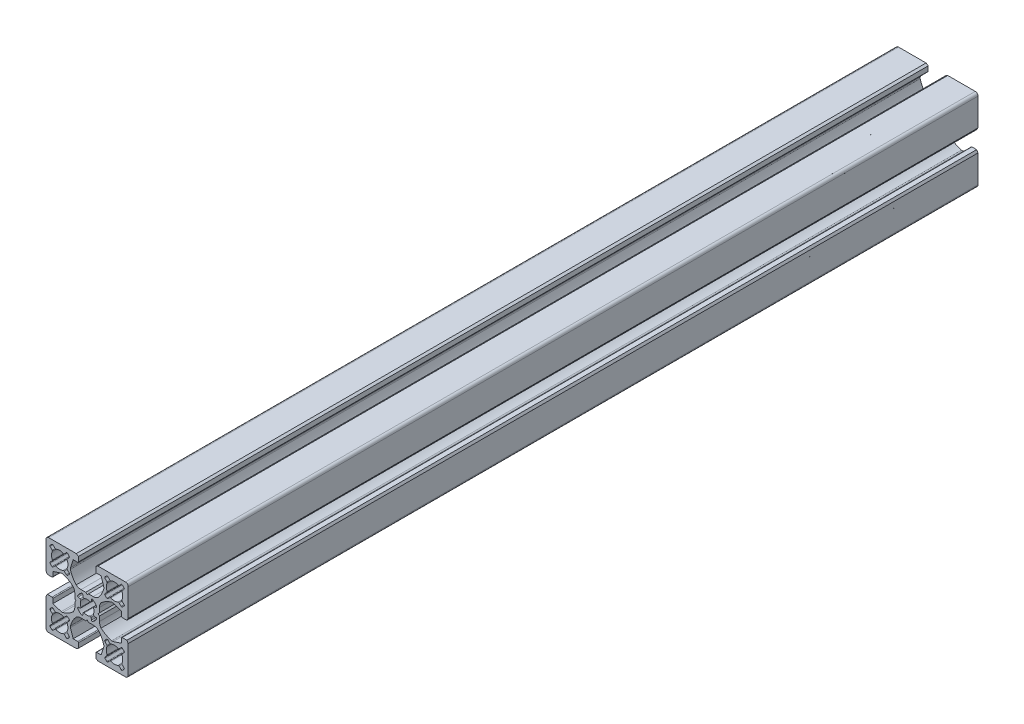
from build123d import *

# Parameters (mm, degrees)
EXTRUDE_1_DEPTH = 310


with BuildPart() as part:
    # Model → 보스-돌출1 (new body)
    with BuildSketch(Plane.XY):
        with BuildLine():
            Line((459.574175407, 182.783831091), (458.774175407, 183.283831091))
            Line((458.774175407, 183.283831091), (458.774175407, 184.983831091))
            ThreePointArc((458.774175407, 184.983831091), (458.862043373, 185.195963125), (459.074175407, 185.283831091))
            Line((459.074175407, 185.283831091), (460.724175407, 185.283831091))
            Line((460.724175407, 185.283831091), (461.711783237, 188.335604532))
            ThreePointArc((461.711783237, 188.335604532), (461.759141443, 188.594081667), (461.737530794, 188.855971354))
            ThreePointArc((461.737530794, 188.855971354), (460.898837663, 190.893750972), (459.628188183, 192.694140329))
            ThreePointArc((459.628188183, 192.694140329), (458.78251429, 193.132596412), (457.842016473, 193.283831091))
            Line((457.842016473, 193.283831091), (456.124175407, 193.283831091))
            Line((456.124175407, 193.283831091), (455.624175407, 193.783831091))
            Line((455.624175407, 193.783831091), (455.124175407, 193.283831091))
            Line((455.124175407, 193.283831091), (453.406334341, 193.283831091))
            ThreePointArc((453.406334341, 193.283831091), (452.465836525, 193.132596412), (451.620162632, 192.694140329))
            ThreePointArc((451.620162632, 192.694140329), (450.349513151, 190.893750972), (449.510820021, 188.855971354))
            ThreePointArc((449.510820021, 188.855971354), (449.489209372, 188.594081667), (449.536567578, 188.335604532))
            Line((449.536567578, 188.335604532), (450.524175407, 185.283831091))
            Line((450.524175407, 185.283831091), (452.174175407, 185.283831091))
            ThreePointArc((452.174175407, 185.283831091), (452.386307442, 185.195963125), (452.474175407, 184.983831091))
            Line((452.474175407, 184.983831091), (452.474175407, 183.283831091))
            Line((452.474175407, 183.283831091), (451.674175407, 182.783831091))
            Line((451.674175407, 182.783831091), (441.624175407, 182.783831091))
            ThreePointArc((441.624175407, 182.783831091), (440.917068626, 183.076724309), (440.624175407, 183.783831091))
            Line((440.624175407, 183.783831091), (440.624175407, 193.833831091))
            Line((440.624175407, 193.833831091), (441.124175407, 194.633831091))
            Line((441.124175407, 194.633831091), (442.824175407, 194.633831091))
            ThreePointArc((442.824175407, 194.633831091), (443.036307442, 194.545963125), (443.124175407, 194.333831091))
            Line((443.124175407, 194.333831091), (443.124175407, 192.683831091))
            Line((443.124175407, 192.683831091), (446.175948849, 191.696223261))
            ThreePointArc((446.175948849, 191.696223261), (446.434425983, 191.648865055), (446.696315671, 191.670475704))
            ThreePointArc((446.696315671, 191.670475704), (448.734095289, 192.509168835), (450.534484646, 193.779818315))
            ThreePointArc((450.534484646, 193.779818315), (450.972940729, 194.625492208), (451.124175407, 195.565990025))
            Line((451.124175407, 195.565990025), (451.124175407, 197.283831091))
            Line((451.124175407, 197.283831091), (451.624175407, 197.783831091))
            Line((451.624175407, 197.783831091), (451.124175407, 198.283831091))
            Line((451.124175407, 198.283831091), (451.124175407, 200.001672157))
            ThreePointArc((451.124175407, 200.001672157), (450.972940729, 200.942169973), (450.534484646, 201.787843866))
            ThreePointArc((450.534484646, 201.787843866), (448.734095289, 203.058493347), (446.696315671, 203.897186477))
            ThreePointArc((446.696315671, 203.897186477), (446.434425983, 203.918797126), (446.175948849, 203.87143892))
            Line((446.175948849, 203.87143892), (443.124175407, 202.883831091))
            Line((443.124175407, 202.883831091), (443.124175407, 201.233831091))
            ThreePointArc((443.124175407, 201.233831091), (443.036307442, 201.021699056), (442.824175407, 200.933831091))
            Line((442.824175407, 200.933831091), (441.124175407, 200.933831091))
            Line((441.124175407, 200.933831091), (440.624175407, 201.733831091))
            Line((440.624175407, 201.733831091), (440.624175407, 211.783831091))
            ThreePointArc((440.624175407, 211.783831091), (440.917068626, 212.490937872), (441.624175407, 212.783831091))
            Line((441.624175407, 212.783831091), (451.674175407, 212.783831091))
            Line((451.674175407, 212.783831091), (452.474175407, 212.283831091))
            Line((452.474175407, 212.283831091), (452.474175407, 210.583831091))
            ThreePointArc((452.474175407, 210.583831091), (452.386307442, 210.371699056), (452.174175407, 210.283831091))
            Line((452.174175407, 210.283831091), (450.524175407, 210.283831091))
            Line((450.524175407, 210.283831091), (449.536567578, 207.232057649))
            ThreePointArc((449.536567578, 207.232057649), (449.489209372, 206.973580515), (449.510820021, 206.711690827))
            ThreePointArc((449.510820021, 206.711690827), (450.349513151, 204.673911209), (451.620162632, 202.873521852))
            ThreePointArc((451.620162632, 202.873521852), (452.465836525, 202.435065769), (453.406334341, 202.283831091))
            Line((453.406334341, 202.283831091), (455.124175407, 202.283831091))
            Line((455.124175407, 202.283831091), (455.624175407, 201.783831091))
            Line((455.624175407, 201.783831091), (456.124175407, 202.283831091))
            Line((456.124175407, 202.283831091), (457.842016473, 202.283831091))
            ThreePointArc((457.842016473, 202.283831091), (458.78251429, 202.435065769), (459.628188183, 202.873521852))
            ThreePointArc((459.628188183, 202.873521852), (460.898837663, 204.673911209), (461.737530794, 206.711690827))
            ThreePointArc((461.737530794, 206.711690827), (461.759141443, 206.973580515), (461.711783237, 207.232057649))
            Line((461.711783237, 207.232057649), (460.724175407, 210.283831091))
            Line((460.724175407, 210.283831091), (459.074175407, 210.283831091))
            ThreePointArc((459.074175407, 210.283831091), (458.862043373, 210.371699056), (458.774175407, 210.583831091))
            Line((458.774175407, 210.583831091), (458.774175407, 212.283831091))
            Line((458.774175407, 212.283831091), (459.574175407, 212.783831091))
            Line((459.574175407, 212.783831091), (469.624175407, 212.783831091))
            ThreePointArc((469.624175407, 212.783831091), (470.331282189, 212.490937872), (470.624175407, 211.783831091))
            Line((470.624175407, 211.783831091), (470.624175407, 201.733831091))
            Line((470.624175407, 201.733831091), (470.124175407, 200.933831091))
            Line((470.124175407, 200.933831091), (468.424175407, 200.933831091))
            ThreePointArc((468.424175407, 200.933831091), (468.212043373, 201.021699056), (468.124175407, 201.233831091))
            Line((468.124175407, 201.233831091), (468.124175407, 202.883831091))
            Line((468.124175407, 202.883831091), (465.072401966, 203.87143892))
            ThreePointArc((465.072401966, 203.87143892), (464.813924831, 203.918797126), (464.552035144, 203.897186477))
            ThreePointArc((464.552035144, 203.897186477), (462.514255526, 203.058493347), (460.713866169, 201.787843866))
            ThreePointArc((460.713866169, 201.787843866), (460.275410086, 200.942169973), (460.124175407, 200.001672157))
            Line((460.124175407, 200.001672157), (460.124175407, 198.283831091))
            Line((460.124175407, 198.283831091), (459.624175407, 197.783831091))
            Line((459.624175407, 197.783831091), (460.124175407, 197.283831091))
            Line((460.124175407, 197.283831091), (460.124175407, 195.565990025))
            ThreePointArc((460.124175407, 195.565990025), (460.275410086, 194.625492208), (460.713866169, 193.779818315))
            ThreePointArc((460.713866169, 193.779818315), (462.514255526, 192.509168835), (464.552035144, 191.670475704))
            ThreePointArc((464.552035144, 191.670475704), (464.813924831, 191.648865055), (465.072401966, 191.696223261))
            Line((465.072401966, 191.696223261), (468.124175407, 192.683831091))
            Line((468.124175407, 192.683831091), (468.124175407, 194.333831091))
            ThreePointArc((468.124175407, 194.333831091), (468.212043373, 194.545963125), (468.424175407, 194.633831091))
            Line((468.424175407, 194.633831091), (470.124175407, 194.633831091))
            Line((470.124175407, 194.633831091), (470.624175407, 193.833831091))
            Line((470.624175407, 193.833831091), (470.624175407, 183.783831091))
            ThreePointArc((470.624175407, 183.783831091), (470.331282189, 183.076724309), (469.624175407, 182.783831091))
            Line((469.624175407, 182.783831091), (459.574175407, 182.783831091))
        make_face()
        with BuildLine():
            Line((462.879323242, 206.101978996), (462.138752469, 205.361408224))
            ThreePointArc((462.138752469, 205.361408224), (462.051316542, 205.165370796), (462.117245146, 204.961093696))
            ThreePointArc((462.117245146, 204.961093696), (462.439854993, 204.601850575), (462.799098114, 204.279240729))
            ThreePointArc((462.799098114, 204.279240729), (463.003375214, 204.213312125), (463.199412641, 204.300748052))
            Line((463.199412641, 204.300748052), (463.939983413, 205.041318824))
            ThreePointArc((463.939983413, 205.041318824), (464.103755722, 205.125263363), (464.285726362, 205.097790817))
            ThreePointArc((464.285726362, 205.097790817), (465.621835508, 204.783831091), (466.957944654, 205.097790817))
            ThreePointArc((466.957944654, 205.097790817), (467.139915294, 205.125263363), (467.303687603, 205.041318824))
            Line((467.303687603, 205.041318824), (468.044258375, 204.300748052))
            ThreePointArc((468.044258375, 204.300748052), (468.240295802, 204.213312125), (468.444572902, 204.279240729))
            ThreePointArc((468.444572902, 204.279240729), (468.803816023, 204.601850575), (469.12642587, 204.961093696))
            ThreePointArc((469.12642587, 204.961093696), (469.192354474, 205.165370796), (469.104918547, 205.361408224))
            Line((469.104918547, 205.361408224), (468.364347775, 206.101978996))
            ThreePointArc((468.364347775, 206.101978996), (468.280403236, 206.265751305), (468.307875782, 206.447721945))
            ThreePointArc((468.307875782, 206.447721945), (468.621835508, 207.783831091), (468.307875782, 209.119940236))
            ThreePointArc((468.307875782, 209.119940236), (468.280403236, 209.301910877), (468.364347774, 209.465683185))
            Line((468.364347774, 209.465683185), (469.104918547, 210.206253957))
            ThreePointArc((469.104918547, 210.206253957), (469.192354474, 210.402291385), (469.12642587, 210.606568485))
            ThreePointArc((469.12642587, 210.606568485), (468.803816023, 210.965811606), (468.444572902, 211.288421452))
            ThreePointArc((468.444572902, 211.288421452), (468.240295802, 211.354350057), (468.044258375, 211.266914129))
            Line((468.044258375, 211.266914129), (467.303687603, 210.526343357))
            ThreePointArc((467.303687603, 210.526343357), (467.139915294, 210.442398819), (466.957944654, 210.469871364))
            ThreePointArc((466.957944654, 210.469871364), (465.621835508, 210.783831091), (464.285726362, 210.469871364))
            ThreePointArc((464.285726362, 210.469871364), (464.103755722, 210.442398819), (463.939983413, 210.526343357))
            Line((463.939983413, 210.526343357), (463.199412641, 211.266914129))
            ThreePointArc((463.199412641, 211.266914129), (463.003375214, 211.354350057), (462.799098114, 211.288421452))
            ThreePointArc((462.799098114, 211.288421452), (462.439854993, 210.965811606), (462.117245146, 210.606568485))
            ThreePointArc((462.117245146, 210.606568485), (462.051316542, 210.402291385), (462.138752469, 210.206253957))
            Line((462.138752469, 210.206253957), (462.879323242, 209.465683185))
            ThreePointArc((462.879323242, 209.465683185), (462.96326778, 209.301910877), (462.935795235, 209.119940236))
            ThreePointArc((462.935795235, 209.119940236), (462.621835508, 207.783831091), (462.935795235, 206.447721945))
            ThreePointArc((462.935795235, 206.447721945), (462.96326778, 206.265751305), (462.879323242, 206.101978996))
        make_face(mode=Mode.SUBTRACT)
        with BuildLine():
            Line((462.878674407, 189.465117129), (462.138161401, 190.205745663))
            ThreePointArc((462.138161401, 190.205745663), (462.050740765, 190.40178991), (462.116685302, 190.606061867))
            ThreePointArc((462.116685302, 190.606061867), (462.439323169, 190.965279823), (462.798591452, 191.287861648))
            ThreePointArc((462.798591452, 191.287861648), (463.002873694, 191.353774318), (463.198904301, 191.2663231))
            Line((463.198904301, 191.2663231), (463.939417306, 190.525694566))
            ThreePointArc((463.939417306, 190.525694566), (464.103183067, 190.441737254), (464.285155849, 190.469195606))
            ThreePointArc((464.285155849, 190.469195606), (465.62128948, 190.783051115), (466.957374133, 190.468987173))
            ThreePointArc((466.957374133, 190.468987173), (467.13934263, 190.441500434), (467.303121485, 190.525432198))
            Line((467.303121485, 190.525432198), (468.04375002, 191.265945204))
            ThreePointArc((468.04375002, 191.265945204), (468.239794266, 191.35336584), (468.444066223, 191.287421303))
            ThreePointArc((468.444066223, 191.287421303), (468.80328418, 190.964783436), (469.125866004, 190.605515153))
            ThreePointArc((469.125866004, 190.605515153), (469.191778675, 190.401232911), (469.104327457, 190.205202304))
            Line((469.104327457, 190.205202304), (468.363698923, 189.464689299))
            ThreePointArc((468.363698923, 189.464689299), (468.27974161, 189.300923538), (468.307199962, 189.118950756))
            ThreePointArc((468.307199962, 189.118950756), (468.621055472, 187.782817125), (468.30699153, 186.446732472))
            ThreePointArc((468.30699153, 186.446732472), (468.279504791, 186.264763975), (468.363436555, 186.100985119))
            Line((468.363436555, 186.100985119), (469.103949561, 185.360356585))
            ThreePointArc((469.103949561, 185.360356585), (469.191370197, 185.164312338), (469.125425659, 184.960040382))
            ThreePointArc((469.125425659, 184.960040382), (468.802787793, 184.600822425), (468.443519509, 184.2782406))
            ThreePointArc((468.443519509, 184.2782406), (468.239237268, 184.21232793), (468.043206661, 184.299779148))
            Line((468.043206661, 184.299779148), (467.302693655, 185.040407682))
            ThreePointArc((467.302693655, 185.040407682), (467.138927895, 185.124364994), (466.956955112, 185.096906643))
            ThreePointArc((466.956955112, 185.096906643), (465.620821482, 184.783051133), (464.284736829, 185.097115075))
            ThreePointArc((464.284736829, 185.097115075), (464.102768332, 185.124601814), (463.938989476, 185.04067005))
            Line((463.938989476, 185.04067005), (463.198360942, 184.300157044))
            ThreePointArc((463.198360942, 184.300157044), (463.002316695, 184.212736408), (462.798044738, 184.278680946))
            ThreePointArc((462.798044738, 184.278680946), (462.438826782, 184.601318812), (462.116244957, 184.960587096))
            ThreePointArc((462.116244957, 184.960587096), (462.050332287, 185.164869337), (462.137783504, 185.360899944))
            Line((462.137783504, 185.360899944), (462.878412039, 186.10141295))
            ThreePointArc((462.878412039, 186.10141295), (462.962369351, 186.26517871), (462.934910999, 186.447151493))
            ThreePointArc((462.934910999, 186.447151493), (462.62105549, 187.783285123), (462.935119432, 189.119369776))
            ThreePointArc((462.935119432, 189.119369776), (462.962606171, 189.301338273), (462.878674407, 189.465117129))
        make_face(mode=Mode.SUBTRACT)
        with BuildLine():
            Line((448.367336509, 189.465117129), (449.107849514, 190.205745663))
            ThreePointArc((449.107849514, 190.205745663), (449.195270151, 190.40178991), (449.129325613, 190.606061867))
            ThreePointArc((449.129325613, 190.606061867), (448.806687747, 190.965279823), (448.447419463, 191.287861648))
            ThreePointArc((448.447419463, 191.287861648), (448.243137222, 191.353774318), (448.047106615, 191.2663231))
            Line((448.047106615, 191.2663231), (447.306593609, 190.525694566))
            ThreePointArc((447.306593609, 190.525694566), (447.142827848, 190.441737254), (446.960855066, 190.469195606))
            ThreePointArc((446.960855066, 190.469195606), (445.624721436, 190.783051115), (444.288636783, 190.468987173))
            ThreePointArc((444.288636783, 190.468987173), (444.106668286, 190.441500434), (443.94288943, 190.525432198))
            Line((443.94288943, 190.525432198), (443.202260896, 191.265945204))
            ThreePointArc((443.202260896, 191.265945204), (443.006216649, 191.35336584), (442.801944692, 191.287421303))
            ThreePointArc((442.801944692, 191.287421303), (442.442726735, 190.964783436), (442.120144911, 190.605515153))
            ThreePointArc((442.120144911, 190.605515153), (442.054232241, 190.401232911), (442.141683458, 190.205202304))
            Line((442.141683458, 190.205202304), (442.882311993, 189.464689299))
            ThreePointArc((442.882311993, 189.464689299), (442.966269305, 189.300923538), (442.938810953, 189.118950756))
            ThreePointArc((442.938810953, 189.118950756), (442.624955444, 187.782817125), (442.939019385, 186.446732472))
            ThreePointArc((442.939019385, 186.446732472), (442.966506124, 186.264763975), (442.88257436, 186.100985119))
            Line((442.88257436, 186.100985119), (442.142061355, 185.360356585))
            ThreePointArc((442.142061355, 185.360356585), (442.054640719, 185.164312338), (442.120585256, 184.960040382))
            ThreePointArc((442.120585256, 184.960040382), (442.443223122, 184.600822425), (442.802491406, 184.2782406))
            ThreePointArc((442.802491406, 184.2782406), (443.006773648, 184.21232793), (443.202804255, 184.299779148))
            Line((443.202804255, 184.299779148), (443.94331726, 185.040407682))
            ThreePointArc((443.94331726, 185.040407682), (444.107083021, 185.124364994), (444.289055803, 185.096906643))
            ThreePointArc((444.289055803, 185.096906643), (445.625189434, 184.783051133), (446.961274087, 185.097115075))
            ThreePointArc((446.961274087, 185.097115075), (447.143242583, 185.124601814), (447.307021439, 185.04067005))
            Line((447.307021439, 185.04067005), (448.047649974, 184.300157044))
            ThreePointArc((448.047649974, 184.300157044), (448.24369422, 184.212736408), (448.447966177, 184.278680946))
            ThreePointArc((448.447966177, 184.278680946), (448.807184134, 184.601318812), (449.129765958, 184.960587096))
            ThreePointArc((449.129765958, 184.960587096), (449.195678629, 185.164869337), (449.108227411, 185.360899944))
            Line((449.108227411, 185.360899944), (448.367598877, 186.10141295))
            ThreePointArc((448.367598877, 186.10141295), (448.283641564, 186.26517871), (448.311099916, 186.447151493))
            ThreePointArc((448.311099916, 186.447151493), (448.624955426, 187.783285123), (448.310891484, 189.119369776))
            ThreePointArc((448.310891484, 189.119369776), (448.283404745, 189.301338273), (448.367336509, 189.465117129))
        make_face(mode=Mode.SUBTRACT)
        with BuildLine():
            Line((457.210300672, 201.021172973), (457.076729929, 200.280239327))
            ThreePointArc((457.076729929, 200.280239327), (456.920864875, 200.06780508), (456.657491136, 200.060288559))
            ThreePointArc((456.657491136, 200.060288559), (455.624175407, 200.283831091), (454.590859679, 200.060288559))
            ThreePointArc((454.590859679, 200.060288559), (454.32748594, 200.06780508), (454.171620886, 200.280239327))
            Line((454.171620886, 200.280239327), (454.038050143, 201.021172973))
            ThreePointArc((454.038050143, 201.021172973), (453.867687152, 201.240722573), (453.590171174, 201.226215416))
            ThreePointArc((453.590171174, 201.226215416), (452.796918232, 200.611088266), (452.181791082, 199.817835324))
            ThreePointArc((452.181791082, 199.817835324), (452.167283925, 199.540319346), (452.386833525, 199.369956355))
            Line((452.386833525, 199.369956355), (453.127767171, 199.236385612))
            ThreePointArc((453.127767171, 199.236385612), (453.340201418, 199.080520558), (453.347717939, 198.817146819))
            ThreePointArc((453.347717939, 198.817146819), (453.124175407, 197.783831091), (453.347717939, 196.750515362))
            ThreePointArc((453.347717939, 196.750515362), (453.340201418, 196.487141623), (453.127767171, 196.331276569))
            Line((453.127767171, 196.331276569), (452.386833525, 196.197705826))
            ThreePointArc((452.386833525, 196.197705826), (452.167283925, 196.027342835), (452.181791082, 195.749826857))
            ThreePointArc((452.181791082, 195.749826857), (452.796918232, 194.956573915), (453.590171174, 194.341446765))
            ThreePointArc((453.590171174, 194.341446765), (453.867687152, 194.326939608), (454.038050143, 194.546489208))
            Line((454.038050143, 194.546489208), (454.171620886, 195.287422854))
            ThreePointArc((454.171620886, 195.287422854), (454.32748594, 195.499857101), (454.590859679, 195.507373622))
            ThreePointArc((454.590859679, 195.507373622), (455.624175407, 195.283831091), (456.657491136, 195.507373622))
            ThreePointArc((456.657491136, 195.507373622), (456.920864875, 195.499857101), (457.076729929, 195.287422854))
            Line((457.076729929, 195.287422854), (457.210300672, 194.546489208))
            ThreePointArc((457.210300672, 194.546489208), (457.380663663, 194.326939608), (457.658179641, 194.341446765))
            ThreePointArc((457.658179641, 194.341446765), (458.451432582, 194.956573915), (459.066559733, 195.749826857))
            ThreePointArc((459.066559733, 195.749826857), (459.08106689, 196.027342835), (458.86151729, 196.197705826))
            Line((458.86151729, 196.197705826), (458.120583644, 196.331276569))
            ThreePointArc((458.120583644, 196.331276569), (457.908149397, 196.487141623), (457.900632876, 196.750515362))
            ThreePointArc((457.900632876, 196.750515362), (458.124175407, 197.783831091), (457.900632876, 198.817146819))
            ThreePointArc((457.900632876, 198.817146819), (457.908149397, 199.080520558), (458.120583644, 199.236385612))
            Line((458.120583644, 199.236385612), (458.86151729, 199.369956355))
            ThreePointArc((458.86151729, 199.369956355), (459.08106689, 199.540319346), (459.066559733, 199.817835324))
            ThreePointArc((459.066559733, 199.817835324), (458.451432582, 200.611088266), (457.658179641, 201.226215416))
            ThreePointArc((457.658179641, 201.226215416), (457.380663663, 201.240722573), (457.210300672, 201.021172973))
        make_face(mode=Mode.SUBTRACT)
        with BuildLine():
            Line((448.366687674, 206.101978996), (449.107258446, 205.361408224))
            ThreePointArc((449.107258446, 205.361408224), (449.194694373, 205.165370796), (449.128765769, 204.961093696))
            ThreePointArc((449.128765769, 204.961093696), (448.806155923, 204.601850575), (448.446912802, 204.279240729))
            ThreePointArc((448.446912802, 204.279240729), (448.242635702, 204.213312125), (448.046598274, 204.300748052))
            Line((448.046598274, 204.300748052), (447.306027502, 205.041318824))
            ThreePointArc((447.306027502, 205.041318824), (447.142255193, 205.125263363), (446.960284553, 205.097790817))
            ThreePointArc((446.960284553, 205.097790817), (445.624175407, 204.783831091), (444.288066262, 205.097790817))
            ThreePointArc((444.288066262, 205.097790817), (444.106095621, 205.125263363), (443.942323313, 205.041318824))
            Line((443.942323313, 205.041318824), (443.20175254, 204.300748052))
            ThreePointArc((443.20175254, 204.300748052), (443.005715113, 204.213312125), (442.801438013, 204.279240729))
            ThreePointArc((442.801438013, 204.279240729), (442.442194892, 204.601850575), (442.119585046, 204.961093696))
            ThreePointArc((442.119585046, 204.961093696), (442.053656441, 205.165370796), (442.141092369, 205.361408224))
            Line((442.141092369, 205.361408224), (442.881663141, 206.101978996))
            ThreePointArc((442.881663141, 206.101978996), (442.965607679, 206.265751305), (442.938135134, 206.447721945))
            ThreePointArc((442.938135134, 206.447721945), (442.624175407, 207.783831091), (442.938135134, 209.119940236))
            ThreePointArc((442.938135134, 209.119940236), (442.965607679, 209.301910877), (442.881663141, 209.465683185))
            Line((442.881663141, 209.465683185), (442.141092369, 210.206253957))
            ThreePointArc((442.141092369, 210.206253957), (442.053656441, 210.402291385), (442.119585046, 210.606568485))
            ThreePointArc((442.119585046, 210.606568485), (442.442194892, 210.965811606), (442.801438013, 211.288421452))
            ThreePointArc((442.801438013, 211.288421452), (443.005715113, 211.354350057), (443.20175254, 211.266914129))
            Line((443.20175254, 211.266914129), (443.942323313, 210.526343357))
            ThreePointArc((443.942323313, 210.526343357), (444.106095621, 210.442398819), (444.288066262, 210.469871364))
            ThreePointArc((444.288066262, 210.469871364), (445.624175407, 210.783831091), (446.960284553, 210.469871364))
            ThreePointArc((446.960284553, 210.469871364), (447.142255193, 210.442398819), (447.306027502, 210.526343357))
            Line((447.306027502, 210.526343357), (448.046598274, 211.266914129))
            ThreePointArc((448.046598274, 211.266914129), (448.242635702, 211.354350056), (448.446912802, 211.288421452))
            ThreePointArc((448.446912802, 211.288421452), (448.806155923, 210.965811606), (449.128765769, 210.606568485))
            ThreePointArc((449.128765769, 210.606568485), (449.194694373, 210.402291385), (449.107258446, 210.206253957))
            Line((449.107258446, 210.206253957), (448.366687674, 209.465683185))
            ThreePointArc((448.366687674, 209.465683185), (448.282743135, 209.301910877), (448.310215681, 209.119940236))
            ThreePointArc((448.310215681, 209.119940236), (448.624175407, 207.783831091), (448.310215681, 206.447721945))
            ThreePointArc((448.310215681, 206.447721945), (448.282743135, 206.265751305), (448.366687674, 206.101978996))
        make_face(mode=Mode.SUBTRACT)
    extrude(amount=EXTRUDE_1_DEPTH)


solid = part.part
